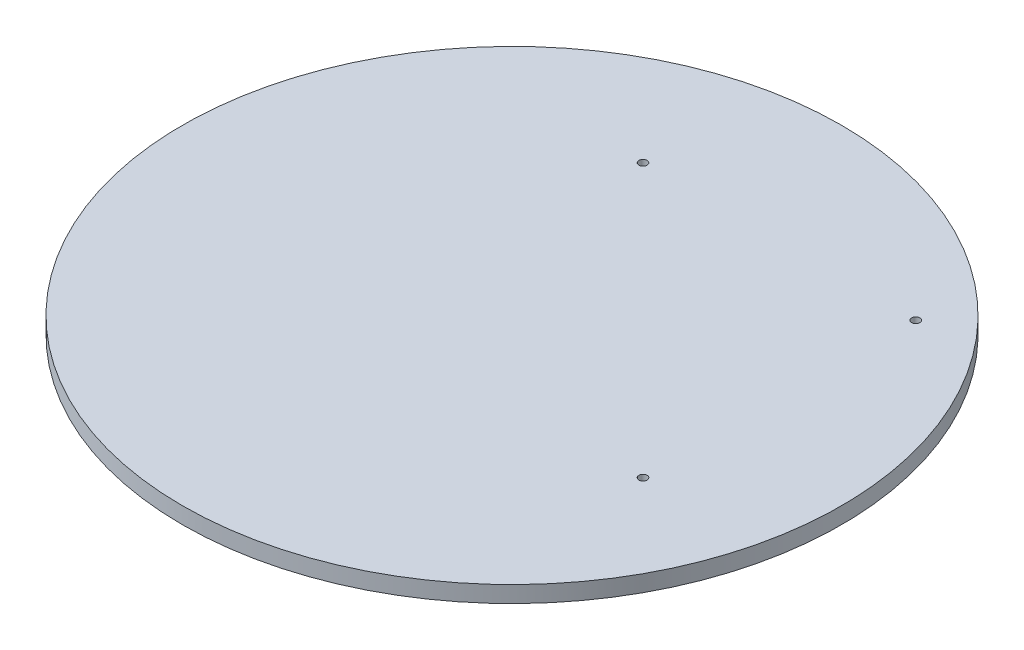
from build123d import *

# Parameters (mm, degrees)
SKETCH1_R           = 200
SKETCH1_R_2         = 2.5
BOSS_EXTRUDE1_DEPTH = 10


with BuildPart() as part:
    # Sketch1 → Boss-Extrude1 (new body)
    with BuildSketch(Plane(origin=(0, 0, 0), x_dir=(1, 0, 0), z_dir=(0, 1, 0))):
        with Locations(Location((0, 0, 0), (0, 0, 270))):
            Circle(SKETCH1_R)
        with Locations(Location((125, 120, 0), (0, 0, 270))):
            Circle(SKETCH1_R_2, mode=Mode.SUBTRACT)
        with Locations(Location((-40.5, 120, 0), (0, 0, 270))):
            Circle(SKETCH1_R_2, mode=Mode.SUBTRACT)
        with Locations(Location((125, -45.5, 0), (0, 0, 270))):
            Circle(SKETCH1_R_2, mode=Mode.SUBTRACT)
    extrude(amount=BOSS_EXTRUDE1_DEPTH)


solid = part.part
